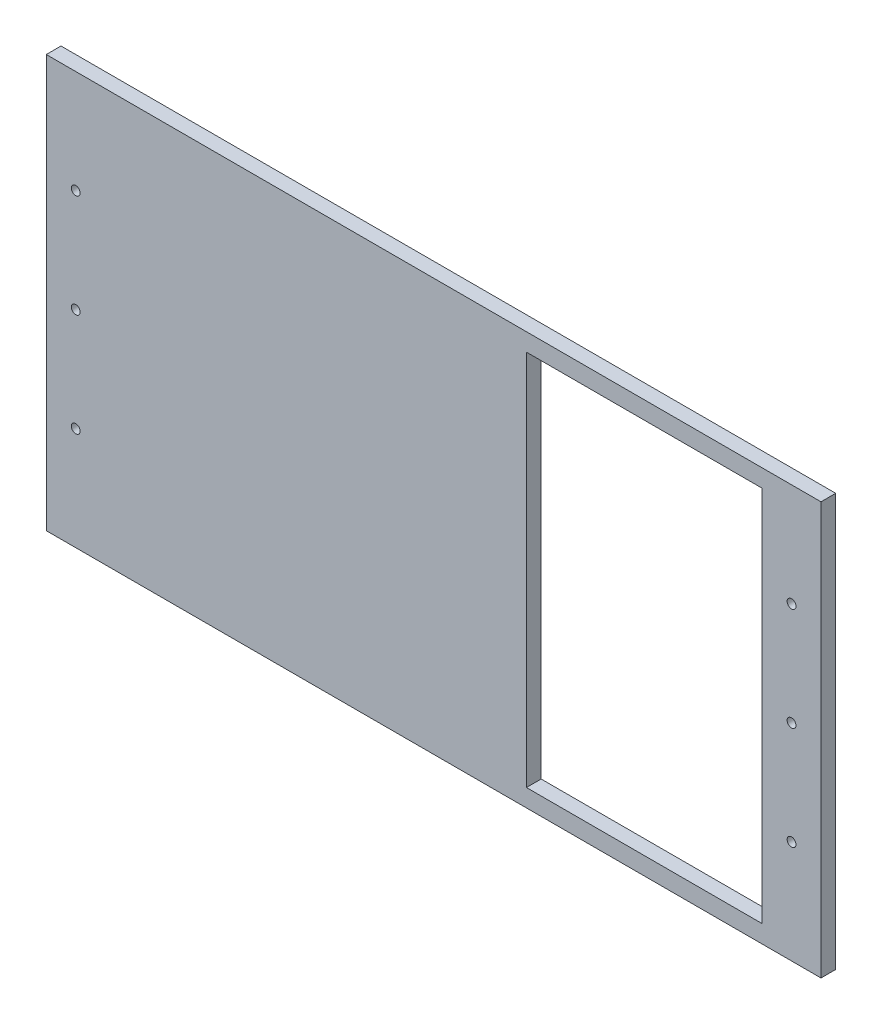
from build123d import *

# Parameters (mm, degrees)
SKETCH_1_W      = 263
SKETCH_1_H      = 140
SKETCH_1_R      = 1.5
SKETCH_1_W_2    = 80
SKETCH_1_H_2    = 128
EXTRUDE_1_DEPTH = 5


with BuildPart() as part:
    # 草图1 → 凸台-拉伸1 (new body)
    with BuildSketch(Plane.XY):
        Rectangle(SKETCH_1_W, SKETCH_1_H)
        with Locations((-121.5, 35)):
            Circle(SKETCH_1_R, mode=Mode.SUBTRACT)
        with Locations((-121.5, 0)):
            Circle(SKETCH_1_R, mode=Mode.SUBTRACT)
        with Locations((-121.5, -35)):
            Circle(SKETCH_1_R, mode=Mode.SUBTRACT)
        with Locations(Location((121.5, -35, 0), (0, 0, 180))):
            Circle(SKETCH_1_R, mode=Mode.SUBTRACT)
        with Locations(Location((121.5, 0, 0), (0, 0, 180))):
            Circle(SKETCH_1_R, mode=Mode.SUBTRACT)
        with Locations(Location((121.5, 35, 0), (0, 0, 180))):
            Circle(SKETCH_1_R, mode=Mode.SUBTRACT)
        with Locations((71.5, 0)):
            Rectangle(SKETCH_1_W_2, SKETCH_1_H_2, mode=Mode.SUBTRACT)
    extrude(amount=EXTRUDE_1_DEPTH)


solid = part.part
